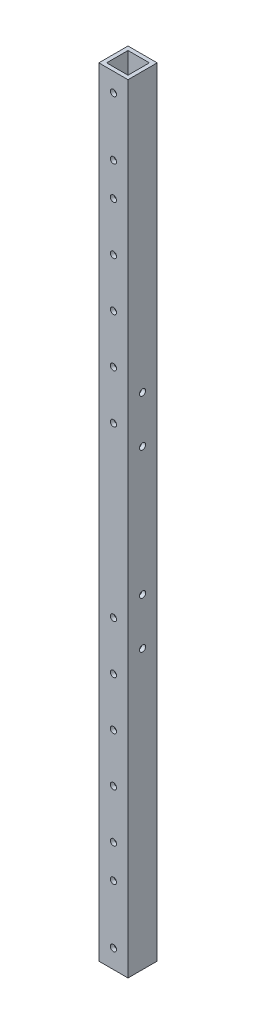
from build123d import *

# Parameters (mm, degrees)
SKETCH1_W           = 15
SKETCH1_H           = 15
SKETCH1_W_2         = 11
SKETCH1_H_2         = 11
BOSS_EXTRUDE1_DEPTH = 400
SKETCH2_R           = 1.6
CUT_EXTRUDE1_DEPTH  = 401.562105047
SKETCH3_R           = 1.6
CUT_EXTRUDE2_DEPTH  = 401.562105047


with BuildPart() as part:
    # Sketch1 → Boss-Extrude1 (new body)
    with BuildSketch(Plane(origin=(0, 0, 0), x_dir=(1, 0, 0), z_dir=(0, 1, 0))):
        with Locations((7.5, 7.5)):
            Rectangle(SKETCH1_W, SKETCH1_H)
        with Locations((7.5, 7.5)):
            Rectangle(SKETCH1_W_2, SKETCH1_H_2, mode=Mode.SUBTRACT)
    extrude(amount=BOSS_EXTRUDE1_DEPTH)

    # Sketch2 → Cut-Extrude1 (cut, through all)
    with BuildSketch(Plane.XY):
        with Locations((7.5, 9.6)):
            Circle(SKETCH2_R)
        with Locations((7.5, 39.6)):
            Circle(SKETCH2_R)
        with Locations((7.5, 56.7)):
            Circle(SKETCH2_R)
        with Locations((7.5, 81.7)):
            Circle(SKETCH2_R)
        with Locations((7.5, 106.7)):
            Circle(SKETCH2_R)
        with Locations((7.5, 131.7)):
            Circle(SKETCH2_R)
        with Locations((7.5, 156.7)):
            Circle(SKETCH2_R)
        with Locations((7.5, 243.3)):
            Circle(SKETCH2_R)
        with Locations((7.5, 268.3)):
            Circle(SKETCH2_R)
        with Locations((7.5, 293.3)):
            Circle(SKETCH2_R)
        with Locations((7.5, 318.3)):
            Circle(SKETCH2_R)
        with Locations((7.5, 343.3)):
            Circle(SKETCH2_R)
        with Locations((7.5, 360.4)):
            Circle(SKETCH2_R)
        with Locations((7.5, 390.4)):
            Circle(SKETCH2_R)
    extrude(amount=-CUT_EXTRUDE1_DEPTH, mode=Mode.SUBTRACT)

    # Sketch3 → Cut-Extrude2 (cut, through all)
    with BuildSketch(Plane(origin=(15, 0, 0), x_dir=(0, 0, -1), z_dir=(1, 0, 0))):
        with Locations((7.5, 143)):
            Circle(SKETCH3_R)
        with Locations((7.5, 167)):
            Circle(SKETCH3_R)
        with Locations((7.5, 233)):
            Circle(SKETCH3_R)
        with Locations((7.5, 257)):
            Circle(SKETCH3_R)
    extrude(amount=-CUT_EXTRUDE2_DEPTH, mode=Mode.SUBTRACT)


solid = part.part
